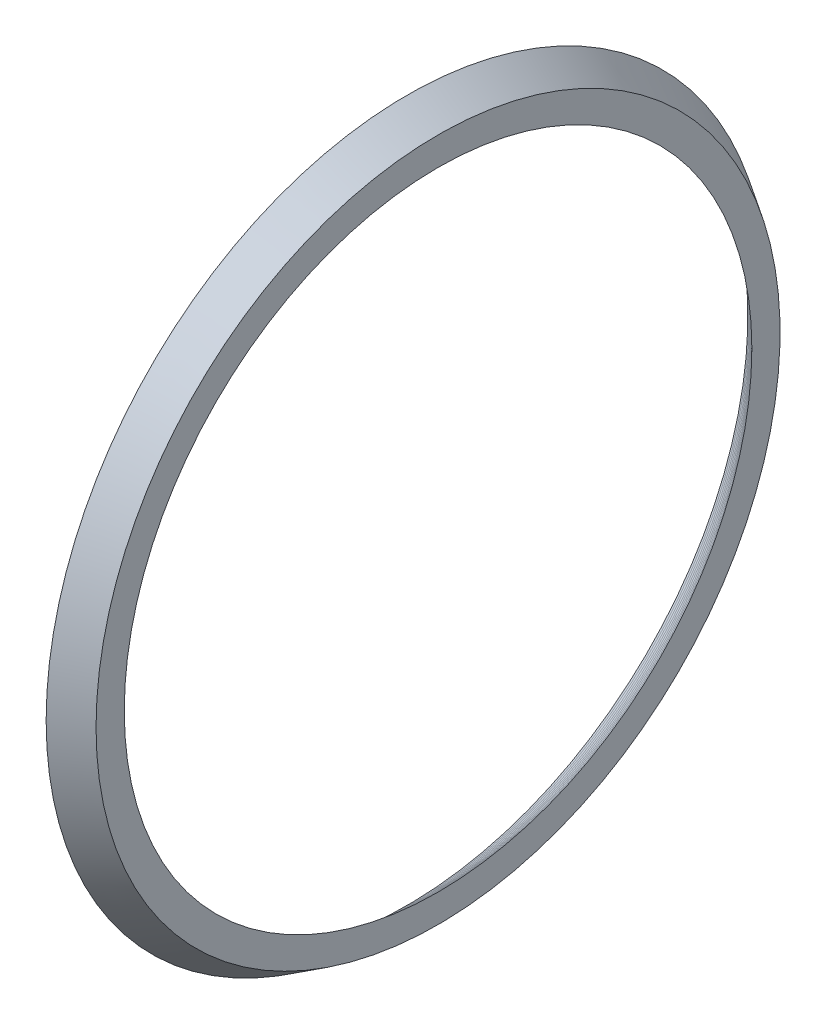
from build123d import *


with BuildPart() as part:
    # Bottle_Liner_Top Sketch → Bottle_Liner_Top (revolve)
    with BuildSketch(Plane.XY):
        Polygon((3.175, 64.694892683), (2.38125, 65.493853894), (1.5875, 66.260295916), (0.79375, 66.99533651), (0, 67.7), (-0.79375, 68.375226954), (-1.5875, 69.021882544), (-2.38125, 69.640763827), (-3.175, 70.232606084), (-3.175, 74.4485), (3.175, 70.5115), align=None)
    revolve(axis=Axis((-300, 0, 0), (1, 0, 0)))


solid = part.part
